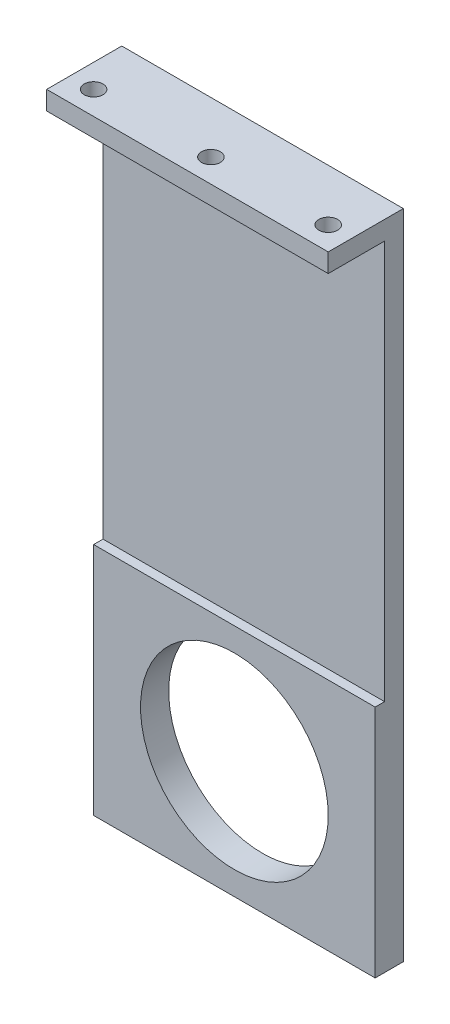
from build123d import *

# Parameters (mm, degrees)
SKETCH1_W           = 60
SKETCH1_H           = 50
SKETCH1_R           = 20
BOSS_EXTRUDE1_DEPTH = 6
SKETCH1_3_W         = 60
SKETCH1_3_H         = 85
BOSS_EXTRUDE2_DEPTH = 4
SKETCH4_W           = 60
SKETCH4_H           = 16
SKETCH4_R           = 2
BOSS_EXTRUDE3_DEPTH = 4


with BuildPart() as part:
    # Sketch1 → Boss-Extrude1 (new body)
    with BuildSketch(Plane.XY):
        Rectangle(SKETCH1_W, SKETCH1_H)
        Circle(SKETCH1_R, mode=Mode.SUBTRACT)
    extrude(amount=BOSS_EXTRUDE1_DEPTH)

    # Sketch1<3> → Boss-Extrude2 (add)
    with BuildSketch(Plane.XY):
        with Locations((0, 67.5)):
            Rectangle(SKETCH1_3_W, SKETCH1_3_H)
    extrude(amount=BOSS_EXTRUDE2_DEPTH)

    # Sketch4 → Boss-Extrude3 (add)
    with BuildSketch(Plane(origin=(0, 110, 0), x_dir=(1, 0, 0), z_dir=(0, 1, 0))):
        with Locations((0, -8)):
            Rectangle(SKETCH4_W, SKETCH4_H)
        with Locations((-25, -11)):
            Circle(SKETCH4_R, mode=Mode.SUBTRACT)
        with Locations((0, -11)):
            Circle(SKETCH4_R, mode=Mode.SUBTRACT)
        with Locations((25, -11)):
            Circle(SKETCH4_R, mode=Mode.SUBTRACT)
    extrude(amount=BOSS_EXTRUDE3_DEPTH)


solid = part.part
